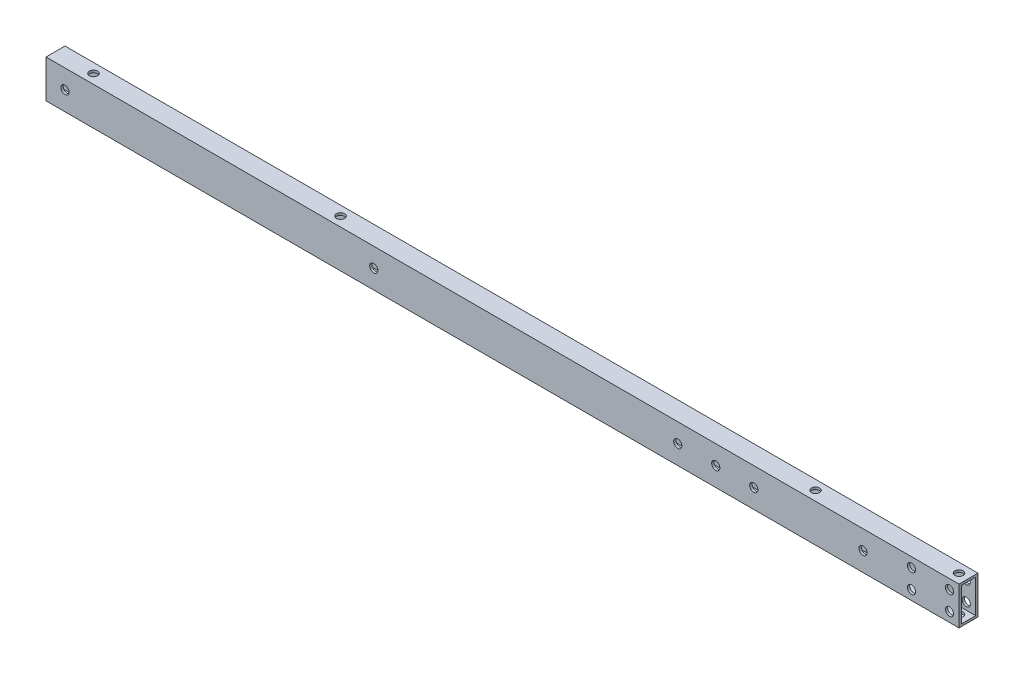
from build123d import *

# Parameters (mm, degrees)
SKETCH_1_W          = 10
SKETCH_1_H          = 20
SKETCH_1_W_2        = 7.6
SKETCH_1_H_2        = 17.6
EXTRUDE_1_DEPTH     = 480.5
SKETCH_2_R          = 2.15
CUT_EXTRUDE_1_DEPTH = 481.708071495
SKETCH_3_R          = 2.15
CUT_EXTRUDE_2_DEPTH = 481.942044326


with BuildPart() as part:
    # ｽｹｯﾁ1 → 押し出し-薄板1 (new body)
    with BuildSketch(Plane(origin=(0, 0, 0), x_dir=(0, 0, -1), z_dir=(1, 0, 0))):
        Rectangle(SKETCH_1_W, SKETCH_1_H)
        Rectangle(SKETCH_1_W_2, SKETCH_1_H_2, mode=Mode.SUBTRACT)
    extrude(amount=EXTRUDE_1_DEPTH)

    # ｽｹｯﾁ2 → ｶｯﾄ - 押し出し1 (cut, through all)
    with BuildSketch(Plane.XY.offset(5)):
        with Locations((372.5, 0)):
            Circle(SKETCH_2_R)
        with Locations(Location((332.5, 0, 0), (0, 0, 90))):
            Circle(SKETCH_2_R)
        with Locations((352.5, 0)):
            Circle(SKETCH_2_R)
        with Locations((172.5, 0)):
            Circle(SKETCH_2_R)
        with Locations((10, 0)):
            Circle(SKETCH_2_R)
        with Locations((475.5, 5)):
            Circle(SKETCH_2_R)
        with Locations(Location((475.5, -5, 0), (0, 0, 90))):
            Circle(SKETCH_2_R)
        with Locations((455.5, 5)):
            Circle(SKETCH_2_R)
        with Locations((455.5, -5)):
            Circle(SKETCH_2_R)
        with Locations((430, 0)):
            Circle(SKETCH_2_R)
    extrude(amount=-CUT_EXTRUDE_1_DEPTH, mode=Mode.SUBTRACT)

    # ｽｹｯﾁ3 → ｶｯﾄ - 押し出し2 (cut, through all)
    with BuildSketch(Plane(origin=(0, 10, 0), x_dir=(1, 0, 0), z_dir=(0, 1, 0))):
        with Locations(Location((400, 0, 0), (0, 0, 270))):
            Circle(SKETCH_3_R)
        with Locations(Location((475.5, 0, 0), (0, 0, 270))):
            Circle(SKETCH_3_R)
        with Locations(Location((150, 0, 0), (0, 0, 270))):
            Circle(SKETCH_3_R)
        with Locations(Location((20, 0, 0), (0, 0, 270))):
            Circle(SKETCH_3_R)
    extrude(amount=-CUT_EXTRUDE_2_DEPTH, mode=Mode.SUBTRACT)


solid = part.part
